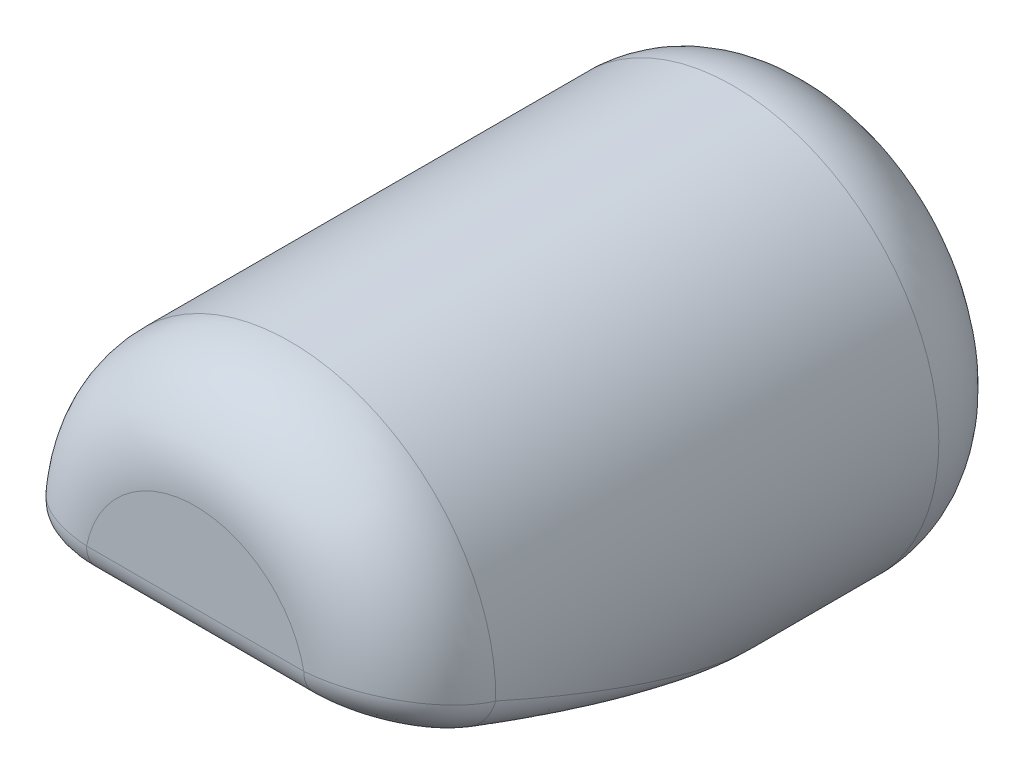
from build123d import *
from build123d.topology import SkipClean

# Parameters (mm, degrees)
SKETCH2_R               = 6.5
BOSS_EXTRUDE1_DEPTH     = 20
FILLET1_R               = 3
CUT_EXTRUDE1_DEPTH      = 10
CUT_EXTRUDE1_DEPTH_BACK = 10
FILLET2_R               = 1


with BuildPart() as part:
    # Sketch2 → Boss-Extrude1 (new body)
    with BuildSketch(Plane.XY):
        Circle(SKETCH2_R)
    extrude(amount=BOSS_EXTRUDE1_DEPTH)

    # Fillet1
    fillet1_edges = [part.edges().sort_by_distance(p)[0] for p in [
        (-6.5, 0, 20),
        (-6.5, 0, 0),
    ]]
    fillet(fillet1_edges, radius=FILLET1_R)

    # Sketch3 → Cut-Extrude1 (cut, two sides: drawn at the far end of the back side and taken through both)
    with SkipClean():  # the faces are left unmerged after this step: merging them gives an invalid solid
        with BuildSketch(Plane(origin=(0, 0, 0), x_dir=(0, 0, -1), z_dir=(1, 0, 0)).offset(-CUT_EXTRUDE1_DEPTH_BACK)):
            Polygon((-20, 0), (-3, -6.5), (-3, -10.4048104), (-20, -10.4048104), align=None)
        extrude(amount=CUT_EXTRUDE1_DEPTH + CUT_EXTRUDE1_DEPTH_BACK, mode=Mode.SUBTRACT)

    # Fillet2
    fillet2_edges = [part.edges().sort_by_distance(p)[0] for p in [
        (4.972878246, -4.185747478, 9.052660442),
        (5.641505344, -0.347957277, 19.089957892),
        (-4.972878247, -4.185747477, 9.052660443),
        (-5.641505316, -0.347957265, 19.089957921),
        (0, 0, 20),
    ]]
    fillet(fillet2_edges, radius=FILLET2_R)


solid = part.part
